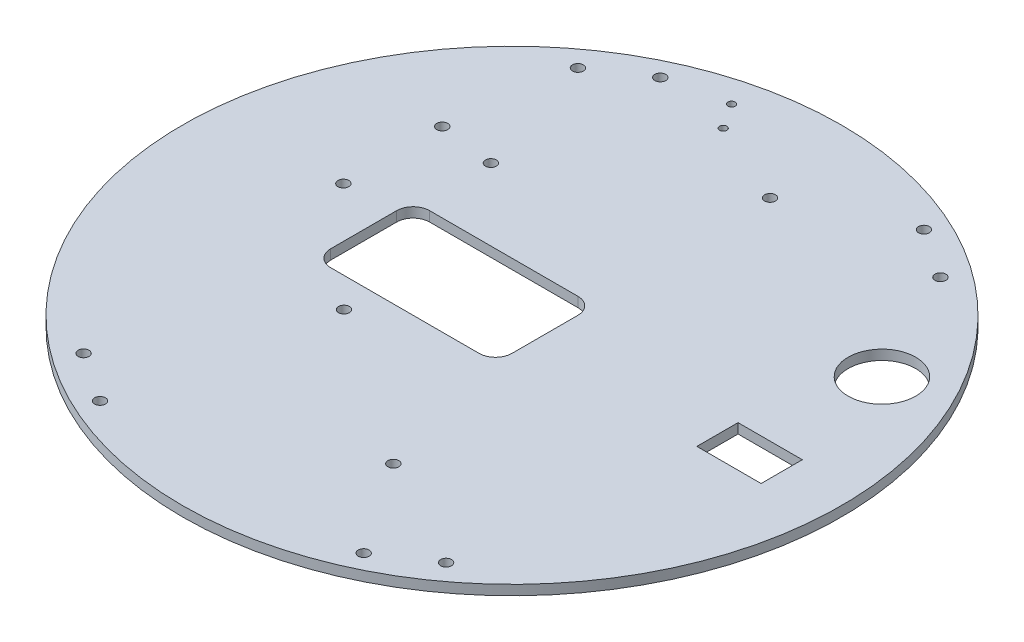
from build123d import *

# Parameters (mm, degrees)
CROQUIS1_R              = 100
CROQUIS1_R_2            = 1.65
CROQUIS1_R_3            = 10.25
CROQUIS1_R_4            = 1.1
CROQUIS1_W              = 19.5
CROQUIS1_H              = 12.5
SALIENTE_EXTRUIR1_DEPTH = 3


with BuildPart() as part:
    # Croquis1 → Saliente-Extruir1 (new body)
    with BuildSketch(Plane(origin=(0, 0, 0), x_dir=(1, 0, 0), z_dir=(0, 1, 0))):
        with Locations(Location((0, 0, 0), (0, 0, 270))):
            Circle(CROQUIS1_R)
        with Locations(Location((55, 75, 0), (0, 0, 270))):
            Circle(CROQUIS1_R_2, mode=Mode.SUBTRACT)
        with Locations(Location((40, -85, 0), (0, 0, 270))):
            Circle(CROQUIS1_R_2, mode=Mode.SUBTRACT)
        with Locations(Location((40, 85, 0), (0, 0, 90))):
            Circle(CROQUIS1_R_2, mode=Mode.SUBTRACT)
        with Locations(Location((-60.20239259, 39.027979594, 0), (0, 0, 270))):
            Circle(CROQUIS1_R_2, mode=Mode.SUBTRACT)
        with Locations(Location((-40, -85, 0), (0, 0, 90))):
            Circle(CROQUIS1_R_2, mode=Mode.SUBTRACT)
        with Locations(Location((-55, -75, 0), (0, 0, 270))):
            Circle(CROQUIS1_R_2, mode=Mode.SUBTRACT)
        with Locations(Location((-55, 75, 0), (0, 0, 90))):
            Circle(CROQUIS1_R_2, mode=Mode.SUBTRACT)
        with Locations(Location((-40, 85, 0), (0, 0, 270))):
            Circle(CROQUIS1_R_2, mode=Mode.SUBTRACT)
        with Locations(Location((-60.20239259, 9.027979594, 0), (0, 0, 270))):
            Circle(CROQUIS1_R_2, mode=Mode.SUBTRACT)
        with Locations(Location((72.25, 40, 0), (0, 0, 270))):
            Circle(CROQUIS1_R_3, mode=Mode.SUBTRACT)
        with Locations(Location((-43.20239259, 36.8, 0), (0, 0, 270))):
            Circle(CROQUIS1_R_2, mode=Mode.SUBTRACT)
        with Locations(Location((8.29760741, 70, 0), (0, 0, 270))):
            Circle(CROQUIS1_R_2, mode=Mode.SUBTRACT)
        with Locations(Location((21, -57, 0), (0, 0, 90))):
            Circle(CROQUIS1_R_2, mode=Mode.SUBTRACT)
        with Locations(Location((-27, -24, 0), (0, 0, 90))):
            Circle(CROQUIS1_R_2, mode=Mode.SUBTRACT)
        with Locations(Location((55, -75, 0), (0, 0, 90))):
            Circle(CROQUIS1_R_2, mode=Mode.SUBTRACT)
        with Locations(Location((-22.18239259, 88.81, 0), (0, 0, 270))):
            Circle(CROQUIS1_R_4, mode=Mode.SUBTRACT)
        with Locations(Location((-17.10239259, 81.19, 0), (0, 0, 270))):
            Circle(CROQUIS1_R_4, mode=Mode.SUBTRACT)
        with BuildLine():
            Line((-40, 15), (5, 15))
            ThreePointArc((5, 15), (8.535533906, 13.535533906), (10, 10))
            Line((10, 10), (10, -10))
            ThreePointArc((10, -10), (8.535533906, -13.535533906), (5, -15))
            Line((5, -15), (-40, -15))
            ThreePointArc((-40, -15), (-43.535533906, -13.535533906), (-45, -10))
            Line((-45, -10), (-45, 10))
            ThreePointArc((-45, 10), (-43.535533906, 13.535533906), (-40, 15))
        make_face(mode=Mode.SUBTRACT)
        with Locations((72.25, -0.158534098)):
            Rectangle(CROQUIS1_W, CROQUIS1_H, mode=Mode.SUBTRACT)
    extrude(amount=SALIENTE_EXTRUIR1_DEPTH)


solid = part.part
